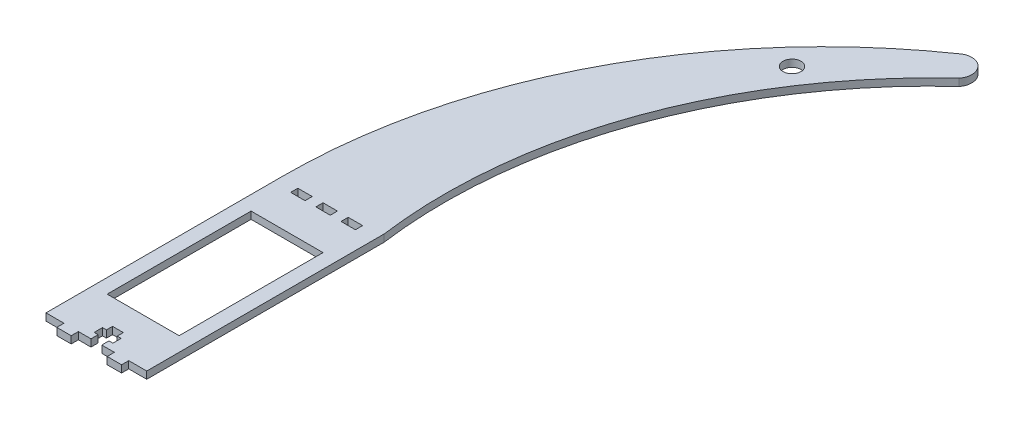
from build123d import *

# Parameters (mm, degrees)
SKETCH1_W           = 20
SKETCH1_H           = 40
SKETCH1_W_2         = 4
SKETCH1_H_2         = 2
BOSS_EXTRUDE1_DEPTH = 2
BOSS_EXTRUDE2_DEPTH = 2
SKETCH3_R           = 2.5
CUT_EXTRUDE1_DEPTH  = 2


with BuildPart() as part:
    # Sketch1 → Boss-Extrude1 (new body)
    with BuildSketch(Plane(origin=(0, 0, 0), x_dir=(1, 0, 0), z_dir=(0, 1, 0))):
        Polygon((0, 0), (5, 0), (5, -2), (9, -2), (9, 0), (12.5, 0), (12.5, 2), (11.4, 2), (11.4, 4.3), (12.5, 4.3), (12.5, 6), (15.5, 6), (15.5, 4.3), (16.6, 4.3), (16.6, 2), (15.5, 2), (15.5, 0), (19, 0), (19, -2), (23, -2), (23, 0), (28, 0), (28, 66), (0, 66), align=None)
        with Locations((14, 33)):
            Rectangle(SKETCH1_W, SKETCH1_H, mode=Mode.SUBTRACT)
        with Locations((7, 64)):
            Rectangle(SKETCH1_W_2, SKETCH1_H_2, mode=Mode.SUBTRACT)
        with Locations((21, 64)):
            Rectangle(SKETCH1_W_2, SKETCH1_H_2, mode=Mode.SUBTRACT)
        with Locations((14, 64)):
            Rectangle(SKETCH1_W_2, SKETCH1_H_2, mode=Mode.SUBTRACT)
    extrude(amount=BOSS_EXTRUDE1_DEPTH)

    # Sketch2 → Boss-Extrude2 (add)
    with BuildSketch(Plane(origin=(0, 2, 0), x_dir=(1, 0, 0), z_dir=(0, 1, 0))):
        with BuildLine():
            Line((0, 66), (28, 66))
            ThreePointArc((28, 66), (34.819271185, 129.864214399), (70.378490249, 183.349560802))
            ThreePointArc((70.378490249, 183.349560802), (70.223472253, 188.82876401), (64.776007814, 189.43772177))
            ThreePointArc((64.776007814, 189.43772177), (17.177564343, 135.700793296), (0, 66))
        make_face()
    extrude(amount=-BOSS_EXTRUDE2_DEPTH)

    # Sketch3 → Cut-Extrude1 (cut)
    with BuildSketch(Plane(origin=(0, 2, 0), x_dir=(1, 0, 0), z_dir=(0, 1, 0))):
        with Locations(Location((44.359461926, 163, 0), (0, 0, 270))):
            Circle(SKETCH3_R)
    extrude(amount=-CUT_EXTRUDE1_DEPTH, mode=Mode.SUBTRACT)


solid = part.part
